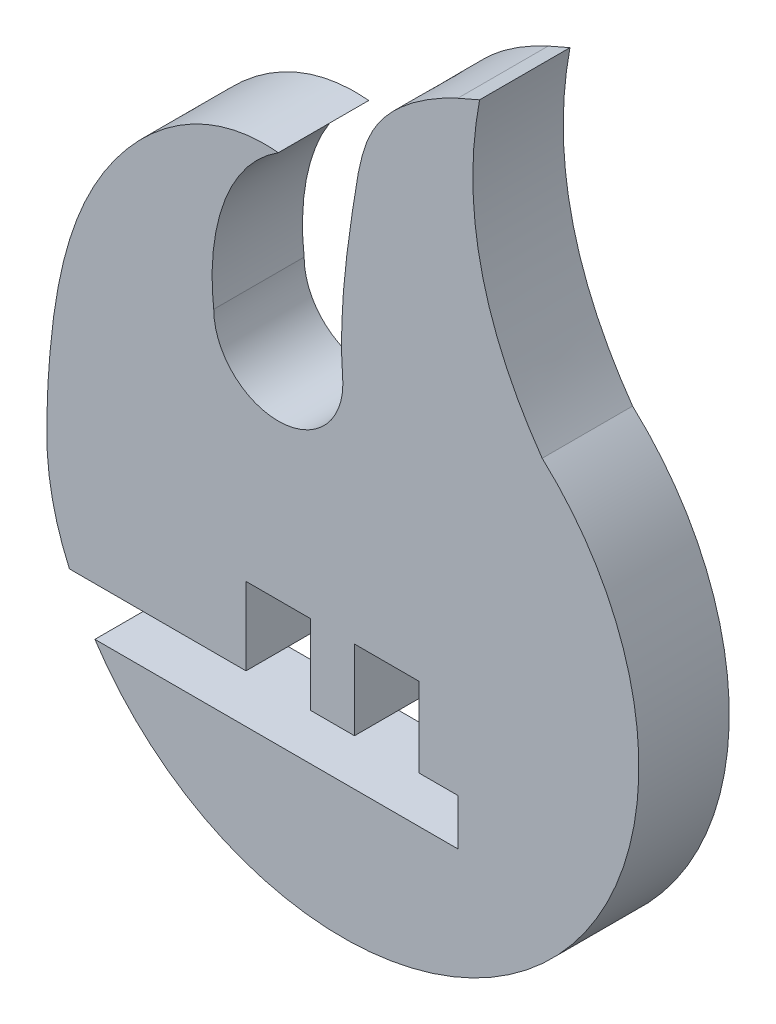
from build123d import *

# Parameters (mm, degrees)
BOSS_EXTRUDE1_DEPTH = 0.7
SCALE1_SCALE        = 3


with BuildPart() as part:
    # Sketch1 → Boss-Extrude1 (new body)
    with BuildSketch(Plane.XY):
        with BuildLine():
            add(Edge.make_bspline(
                [(1.308612852, 4.749134037), (1.089185384, 3.585197579), (1.793550911, 2.587518606)],
                knots=[0, 0, 0, 1, 1, 1], degree=2))
            ThreePointArc((1.793550911, 2.587518606), (1.734959229, -0.853049688), (-1.670369344, -0.358397807))
            Line((-1.670369344, -0.358397807), (1.14, -0.358397807))
            Line((1.14, -0.358397807), (1.14, 0))
            Line((1.14, 0), (0.84, 0))
            Line((0.84, 0), (0.84, 0.615282796))
            Line((0.84, 0.615282796), (0.34, 0.615282796))
            Line((0.34, 0.615282796), (0.34, 0))
            Line((0.34, 0), (0, 0))
            Line((0, 0), (0, 0.615282796))
            Line((0, 0.615282796), (-0.5, 0.615282796))
            Line((-0.5, 0.615282796), (-0.5, 0.015282796))
            Line((-0.5, 0.015282796), (-1.86741437, 0.015282796))
            add(Edge.make_bspline(
                [(-1.86741437, 0.015282796), (-1.967195235, 0.235858372), (-2.024440964, 0.467418027), (-2.039152584, 0.709940467)],
                knots=[0, 0, 0, 0, 0.800781106, 0.800781106, 0.800781106, 0.800781106], degree=3))
            add(Edge.make_bspline(
                [(-2.039152584, 0.709940467), (-2.047148733, 0.925627975), (-2.02218467, 1.604112941), (-1.789435207, 2.864813182), (-0.855181509, 3.674882666), (-0.25, 3.615282796)],
                knots=[0.156243254, 0.156243254, 0.156243254, 0.156243254, 0.300823298, 0.609121374, 1, 1, 1, 1], degree=3))
            add(Edge.make_bspline(
                [(-0.25, 3.615282796), (-0.677964438, 3.343186963), (-0.807483326, 2.788196328), (-0.75, 2.315282796)],
                knots=[0, 0, 0, 0, 1, 1, 1, 1], degree=3))
            ThreePointArc((-0.75, 2.315282796), (-0.25, 1.815282796), (0.25, 2.315282796))
            add(Edge.make_bspline(
                [(0.25, 2.315282796), (0.215460935, 2.756941027), (0.29493392, 3.342860109), (0.442449357, 4.258464168), (0.878924002, 4.555096789), (1.14, 4.675619868)],
                knots=[0, 0, 0, 0, 0.483638441, 0.672292201, 1, 1, 1, 1], degree=3))
            add(Edge.make_bspline(
                [(1.14, 4.675619868), (1.224306426, 4.712376952), (1.308612852, 4.749134037)],
                knots=[0, 0, 0, 0.865241942, 0.865241942, 0.865241942], degree=2))
        make_face()
    extrude(amount=BOSS_EXTRUDE1_DEPTH)


with BuildPart() as part_1:
    # Scale1: scaled about (0.30944177, 1.215178074, 0.35)
    add(part.part.scale(SCALE1_SCALE).moved(Location((-0.61888354, -2.430356148, -0.7))))


solid = part_1.part
